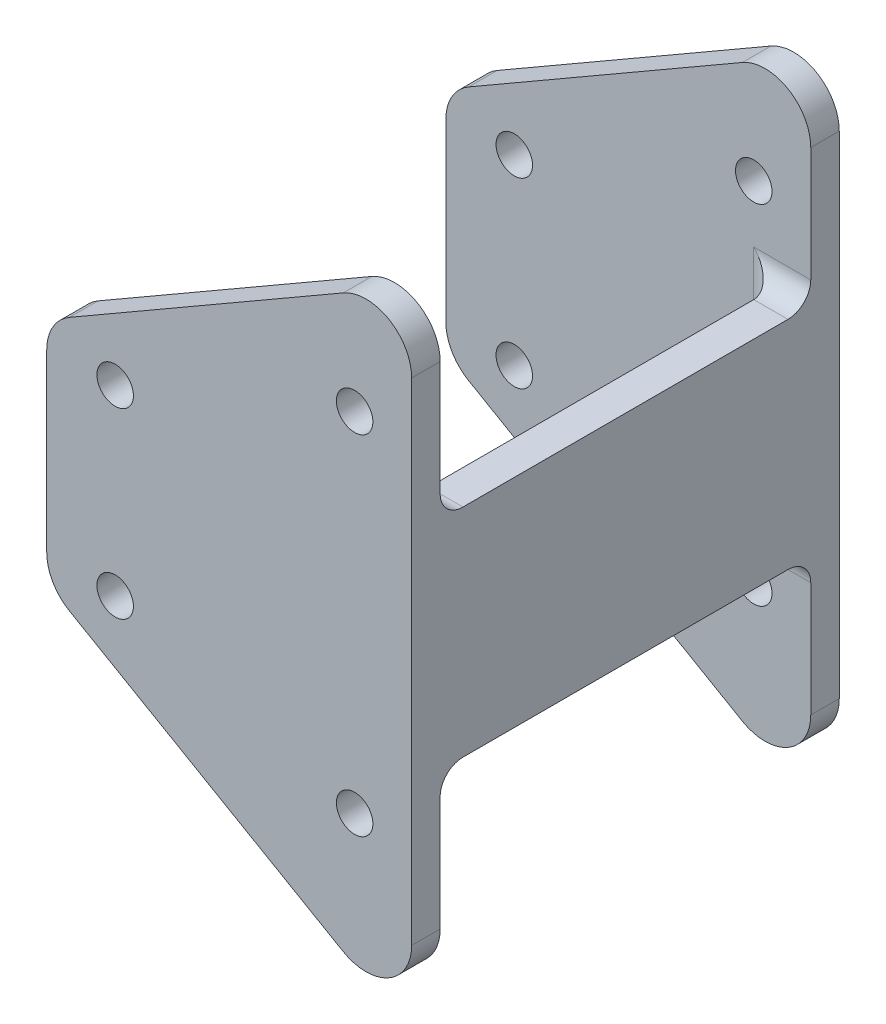
from build123d import *

# Parameters (mm, degrees)
BOSS_EXTRUDE1_DEPTH     = 2.5
SKETCH3_W               = 3
SKETCH3_H               = 19
BOSS_EXTRUDE2_DEPTH     = 35
LPATTERN1_COUNT         = 2
LPATTERN1_PITCH         = 35
CUT_EXTRUDE2_DEPTH      = 54.866960969
CUT_EXTRUDE2_DEPTH_BACK = 10
SKETCH6_R               = 1.6
SKETCH8_R               = 1.6
CUT_EXTRUDE4_DEPTH      = 56.523864095
FILLET1_R               = 2
FILLET2_R               = 2


with BuildPart() as part:
    # Sketch2 → Boss-Extrude1 (new body)
    with BuildSketch(Plane.XY):
        with BuildLine():
            Line((-32, -7.690598923), (-32, 7.690598923))
            ThreePointArc((-32, 7.690598923), (-31.464101615, 9.690598923), (-30, 11.154700538))
            Line((-30, 11.154700538), (-6, 25.011106999))
            ThreePointArc((-6, 25.011106999), (-2, 25.011106999), (0, 21.547005384))
            Line((0, 21.547005384), (0, -21.547005384))
            ThreePointArc((0, -21.547005384), (-2, -25.011106999), (-6, -25.011106999))
            Line((-6, -25.011106999), (-30, -11.154700538))
            ThreePointArc((-30, -11.154700538), (-31.464101615, -9.690598923), (-32, -7.690598923))
        make_face()
    boss_extrude1 = extrude(amount=BOSS_EXTRUDE1_DEPTH)

    # Sketch3 → Boss-Extrude2 (add)
    with BuildSketch(Plane.XY.offset(2.5)):
        with Locations((-1.5, 0)):
            Rectangle(SKETCH3_W, SKETCH3_H)
    extrude(amount=BOSS_EXTRUDE2_DEPTH)

    # LPattern1: Boss-Extrude1 ×2
    with Locations(*[(0, 0, i * LPATTERN1_PITCH) for i in range(1, LPATTERN1_COUNT)]):
        add(boss_extrude1)

    # Sketch6 → Cut-Extrude2 (cut, two sides: drawn at the far end of the back side and taken through both)
    with BuildSketch(Plane.XY.offset(2.5).offset(-CUT_EXTRUDE2_DEPTH_BACK)):
        with Locations(Location((-26, 8, 0), (0, 0, 180))):
            Circle(SKETCH6_R)
        with Locations(Location((-26, -8, 0), (0, 0, 180))):
            Circle(SKETCH6_R)
    extrude(amount=CUT_EXTRUDE2_DEPTH + CUT_EXTRUDE2_DEPTH_BACK, mode=Mode.SUBTRACT)

    # Sketch8 → Cut-Extrude4 (cut, through all)
    with BuildSketch(Plane.XY.offset(37.5)):
        with Locations((-5, 16.511106999)):
            Circle(SKETCH8_R)
        with Locations((-5, -14.011106999)):
            Circle(SKETCH8_R)
    extrude(amount=-CUT_EXTRUDE4_DEPTH, mode=Mode.SUBTRACT)

    # Fillet1
    fillet1_edges = [part.edges().sort_by_distance(p)[0] for p in [
        (-1.5, 9.5, 2.5),
        (-1.5, -9.5, 2.5),
        (-1.5, -9.5, 35),
        (-1.5, 9.5, 35),
    ]]
    fillet(fillet1_edges, radius=FILLET1_R)

    # Fillet2
    fillet2_edges = [part.edges().sort_by_distance(p)[0] for p in [
        (-3, 0, 2.5),
        (-3, 0, 35),
    ]]
    fillet(fillet2_edges, radius=FILLET2_R)


solid = part.part
